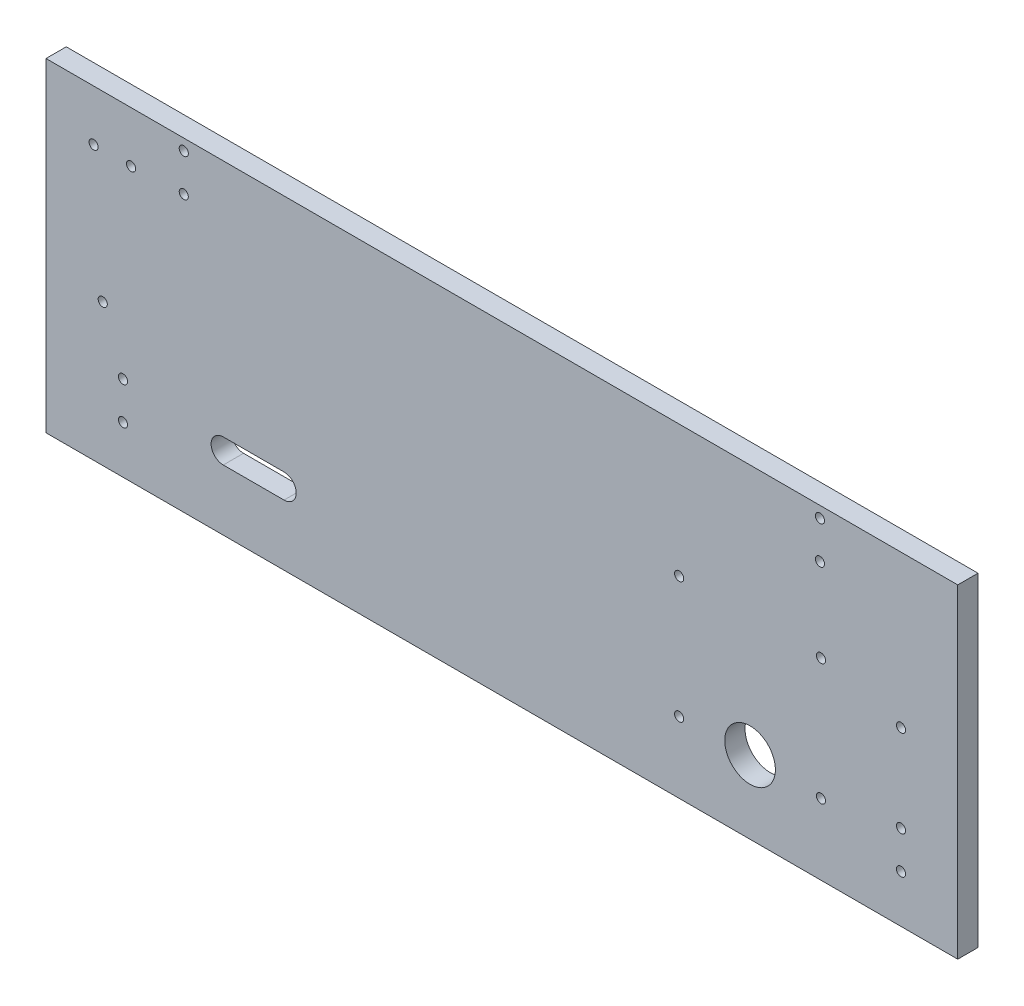
from build123d import *

# Parameters (mm, degrees)
SCHIZZO1_W                   = 450
SCHIZZO1_H                   = 160
ESTRUSIONE_ESTRUSIONE1_DEPTH = 10
SCHIZZO2_R                   = 12.5
SCHIZZO2_R_2                 = 2.25
TAGLIO_ESTRUSIONE1_DEPTH     = 10


with BuildPart() as part:
    # Schizzo1 → Estrusione-Estrusione1 (new body)
    with BuildSketch(Plane.XY):
        with Locations((225, 80)):
            Rectangle(SCHIZZO1_W, SCHIZZO1_H)
    extrude(amount=ESTRUSIONE_ESTRUSIONE1_DEPTH)

    # Schizzo2 → Taglio-Estrusione1 (cut)
    with BuildSketch(Plane.XY.offset(10)):
        with Locations((347.5, 36)):
            Circle(SCHIZZO2_R)
        with Locations((68, 154.5)):
            Circle(SCHIZZO2_R_2)
        with Locations((68, 136)):
            Circle(SCHIZZO2_R_2)
        with Locations((382, 154.5)):
            Circle(SCHIZZO2_R_2)
        with Locations((382, 136)):
            Circle(SCHIZZO2_R_2)
        with Locations((38, 42)):
            Circle(SCHIZZO2_R_2)
        with Locations((38, 23.5)):
            Circle(SCHIZZO2_R_2)
        with Locations((422, 42)):
            Circle(SCHIZZO2_R_2)
        with Locations((422, 23.5)):
            Circle(SCHIZZO2_R_2)
        with Locations((23.5, 134.933694222)):
            Circle(SCHIZZO2_R_2)
        with Locations((42, 134.933694222)):
            Circle(SCHIZZO2_R_2)
        with Locations((28, 70)):
            Circle(SCHIZZO2_R_2)
        with Locations((422, 85)):
            Circle(SCHIZZO2_R_2)
        with Locations((312.5, 95)):
            Circle(SCHIZZO2_R_2)
        with Locations((382.5, 95)):
            Circle(SCHIZZO2_R_2)
        with Locations((382.5, 35)):
            Circle(SCHIZZO2_R_2)
        with Locations((312.5, 35)):
            Circle(SCHIZZO2_R_2)
        with BuildLine():
            Line((87.5, 42), (117.5, 42))
            ThreePointArc((117.5, 42), (123.5, 36), (117.5, 30))
            Line((117.5, 30), (87.5, 30))
            ThreePointArc((87.5, 30), (81.5, 36), (87.5, 42))
        make_face()
    extrude(amount=-TAGLIO_ESTRUSIONE1_DEPTH, mode=Mode.SUBTRACT)


solid = part.part
